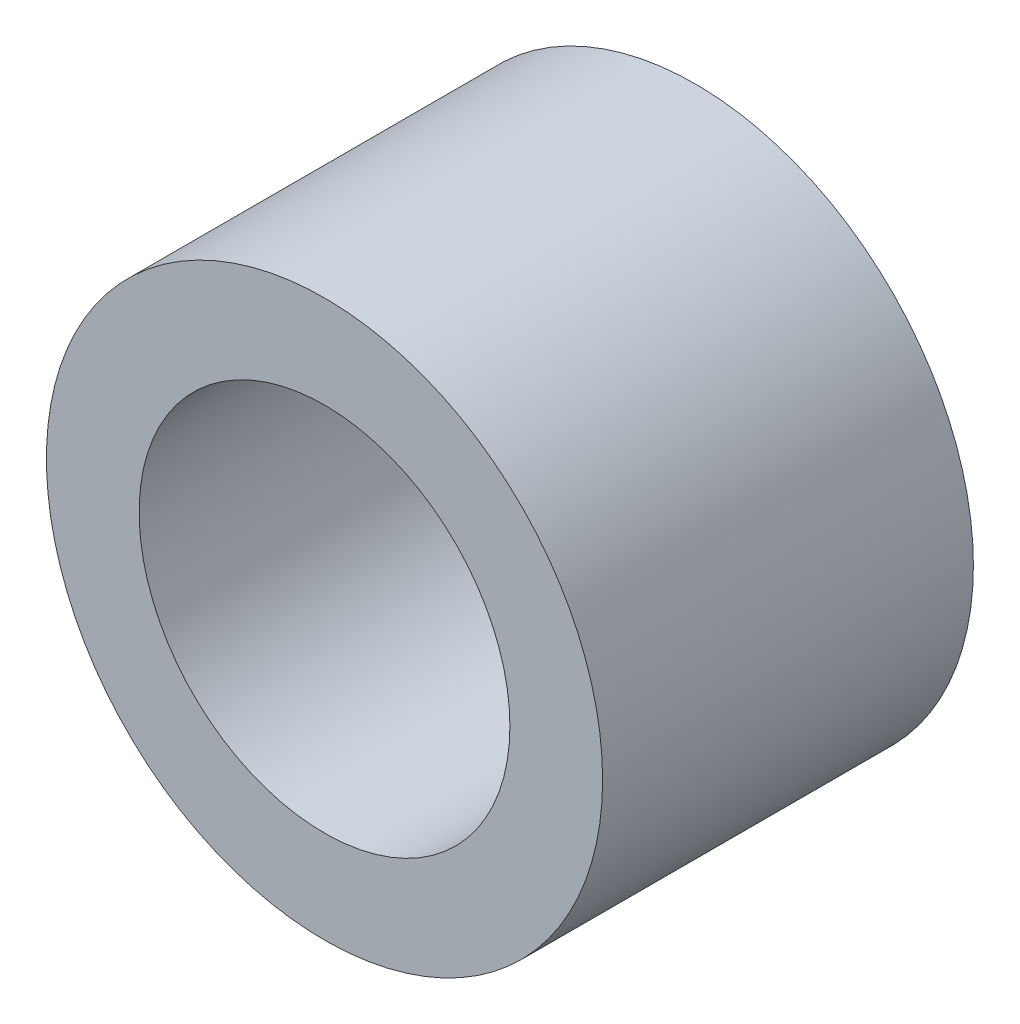
from build123d import *

# Parameters (mm, degrees)
SKETCH1_R      = 4.7625
SKETCH1_R_2    = 3.175
EXTRUDE1_DEPTH = 3.175


with BuildPart() as part:
    # Sketch1 → Extrude1 (new, symmetric)
    with BuildSketch(Plane.XY):
        Circle(SKETCH1_R)
        Circle(SKETCH1_R_2, mode=Mode.SUBTRACT)
    extrude(amount=EXTRUDE1_DEPTH, both=True)


solid = part.part
